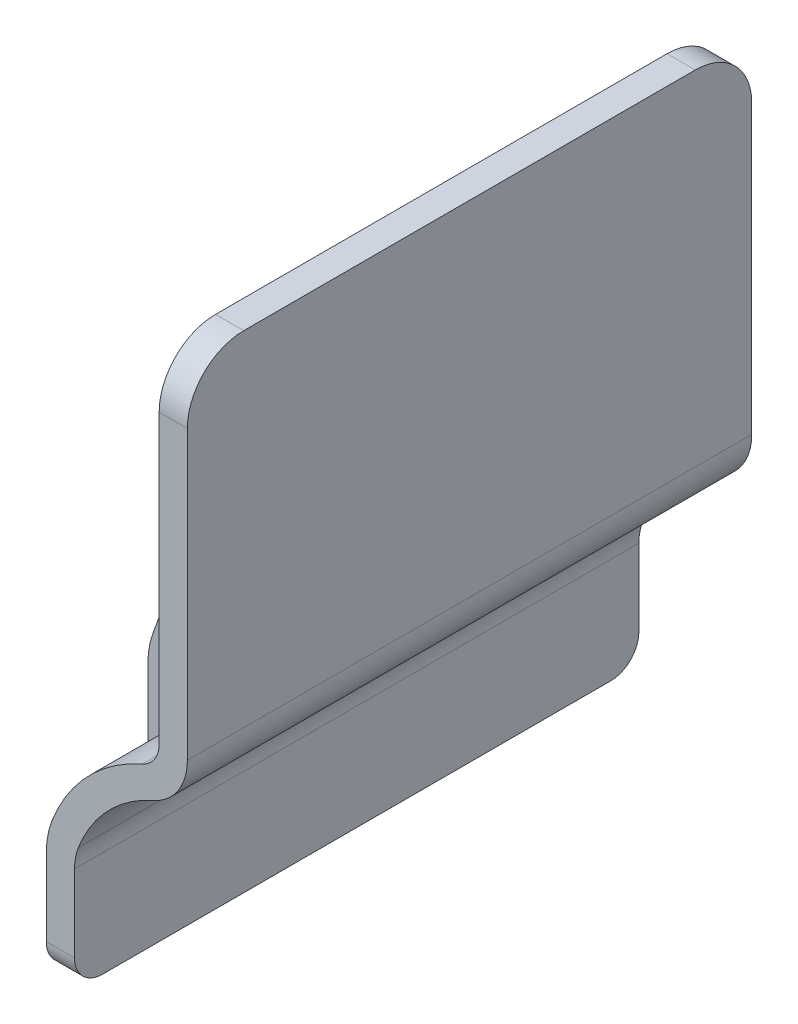
from build123d import *

# Parameters (mm, degrees)
BOSS_EXTRUDE1_DEPTH = 50
FILLET1_R           = 10
FILLET2_R           = 5
BOSS_EXTRUDE3_DEPTH = 2
BOSS_EXTRUDE4_DEPTH = 2


with BuildPart() as part:
    # Sketch2 → Boss-Extrude1 (new, symmetric)
    with BuildSketch(Plane.XY.offset(-83)):
        with BuildLine():
            Line((-4, 165.635164807), (-4, 147))
            Line((-4, 147), (-9, 147))
            Line((-9, 147), (-9, 165.635164807))
            ThreePointArc((-9, 165.635164807), (-8.747881204, 168.373777595), (-8, 171.020329614))
            ThreePointArc((-8, 171.020329614), (-1.677925359, 180.988070116), (8, 187.74545417))
            ThreePointArc((8, 187.74545417), (10.183300133, 189.589417077), (11, 192.328029865))
            Line((11, 192.328029865), (11, 253.25))
            Line((11, 253.25), (16, 253.25))
            Line((16, 253.25), (16, 192.328029865))
            ThreePointArc((16, 192.328029865), (14.366600265, 186.85080429), (10, 183.162878475))
            ThreePointArc((10, 183.162878475), (1.935062201, 177.531725097), (-3.333333333, 169.225274679))
            ThreePointArc((-3.333333333, 169.225274679), (-3.831920803, 167.460906665), (-4, 165.635164807))
        make_face()
    extrude(amount=BOSS_EXTRUDE1_DEPTH, both=True)

    # Fillet1
    fillet1_edges = [part.edges().sort_by_distance(p)[0] for p in [
        (13.5, 253.25, -133),
        (13.5, 253.25, -33),
    ]]
    fillet(fillet1_edges, radius=FILLET1_R)

    # Fillet2
    fillet2_edges = [part.edges().sort_by_distance(p)[0] for p in [
        (-6.5, 147, -133),
        (-6.5, 147, -33),
    ]]
    fillet(fillet2_edges, radius=FILLET2_R)

    # Sketch4 → Boss-Extrude3 (add, symmetric)
    with BuildSketch(Plane.XY.offset(-53)):
        with BuildLine():
            Line((10.095389312, 240.764602561), (-8.095389312, 190.78584905))
            ThreePointArc((-8.095389312, 190.78584905), (-8.772116295, 188.260269565), (-9, 185.6555469))
            Line((-9, 185.6555469), (-9, 165.635164807))
            ThreePointArc((-9, 165.635164807), (-8.747881204, 168.373777595), (-8, 171.020329614))
            ThreePointArc((-8, 171.020329614), (-1.677925359, 180.988070116), (8, 187.74545417))
            ThreePointArc((8, 187.74545417), (10.183300133, 189.589417077), (11, 192.328029865))
            Line((11, 192.328029865), (11, 245.894904711))
            ThreePointArc((11, 245.894904711), (10.772116295, 243.290182046), (10.095389312, 240.764602561))
        make_face()
    extrude(amount=BOSS_EXTRUDE3_DEPTH, both=True)

    # Sketch5 → Boss-Extrude4 (add, symmetric)
    with BuildSketch(Plane(origin=(0, 0, -113), x_dir=(-1, 0, 0), z_dir=(0, 0, -1))):
        with BuildLine():
            Line((-11, 245.894904711), (-11, 192.328029865))
            ThreePointArc((-11, 192.328029865), (-10.183300133, 189.589417077), (-8, 187.74545417))
            ThreePointArc((-8, 187.74545417), (1.677925359, 180.988070116), (8, 171.020329614))
            ThreePointArc((8, 171.020329614), (8.747881204, 168.373777595), (9, 165.635164807))
            Line((9, 165.635164807), (9, 185.6555469))
            ThreePointArc((9, 185.6555469), (8.772116295, 188.260269565), (8.095389312, 190.78584905))
            Line((8.095389312, 190.78584905), (-10.095389312, 240.764602561))
            ThreePointArc((-10.095389312, 240.764602561), (-10.772116295, 243.290182046), (-11, 245.894904711))
        make_face()
    extrude(amount=BOSS_EXTRUDE4_DEPTH, both=True)


solid = part.part
